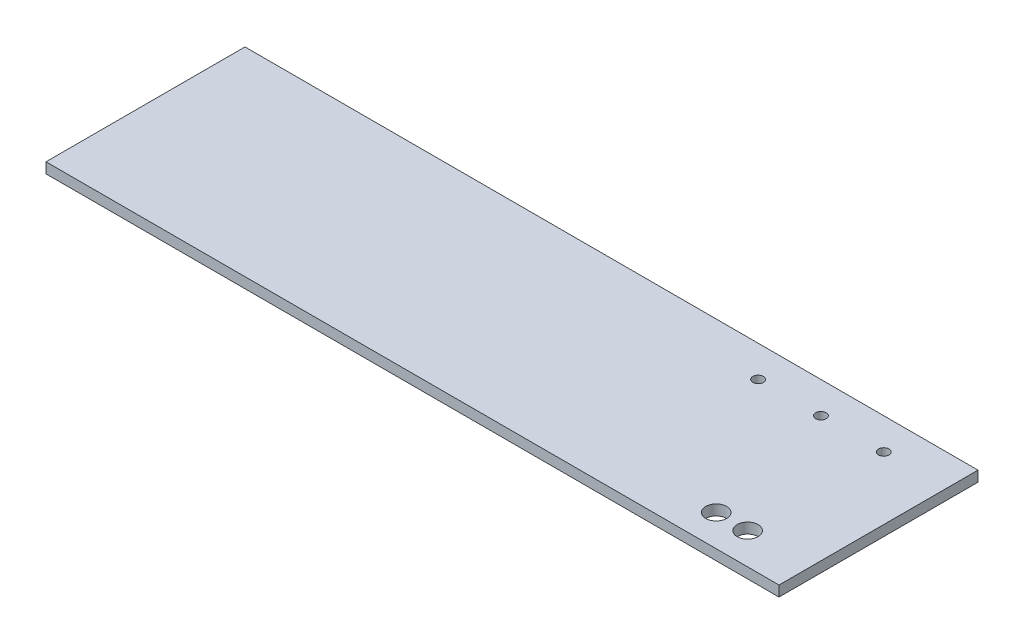
from build123d import *

# Parameters (mm, degrees)
CROQUIS1_W              = 700
CROQUIS1_H              = 190
SALIENTE_EXTRUIR1_DEPTH = 10
CROQUIS2_R              = 5
CROQUIS2_R_2            = 10
CORTAR_EXTRUIR1_DEPTH   = 10


with BuildPart() as part:
    # Croquis1 → Saliente-Extruir1 (new body)
    with BuildSketch(Plane(origin=(0, 0, 0), x_dir=(1, 0, 0), z_dir=(0, 1, 0))):
        Rectangle(CROQUIS1_W, CROQUIS1_H)
    extrude(amount=SALIENTE_EXTRUIR1_DEPTH)

    # Croquis2 → Cortar-Extruir1 (cut)
    with BuildSketch(Plane(origin=(0, 10, 0), x_dir=(1, 0, 0), z_dir=(0, 1, 0))):
        with Locations(Location((290, 65, 0), (0, 0, 270))):
            Circle(CROQUIS2_R)
        with Locations(Location((230, 65, 0), (0, 0, 270))):
            Circle(CROQUIS2_R)
        with Locations(Location((170, 65, 0), (0, 0, 270))):
            Circle(CROQUIS2_R)
        with Locations(Location((290, -65, 0), (0, 0, 270))):
            Circle(CROQUIS2_R_2)
        with Locations(Location((260, -65, 0), (0, 0, 270))):
            Circle(CROQUIS2_R_2)
    extrude(amount=-CORTAR_EXTRUIR1_DEPTH, mode=Mode.SUBTRACT)


solid = part.part
